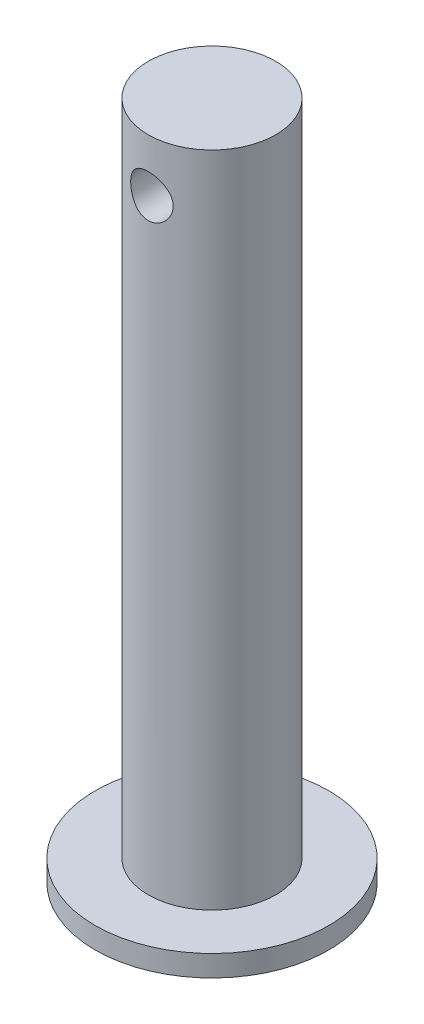
from build123d import *

# Parameters (mm, degrees)
SKETCH1_R           = 5.5
BOSS_EXTRUDE1_DEPTH = 1
SKETCH2_R           = 3
BOSS_EXTRUDE2_DEPTH = 31
SKETCH3_R           = 1
CUT_EXTRUDE1_DEPTH  = 15.5


with BuildPart() as part:
    # Sketch1 → Boss-Extrude1 (new body)
    with BuildSketch(Plane(origin=(0, 0, 0), x_dir=(1, 0, 0), z_dir=(0, 1, 0))):
        with Locations(Location((0, 0, 0), (0, 0, 270))):
            Circle(SKETCH1_R)
    extrude(amount=BOSS_EXTRUDE1_DEPTH)

    # Sketch2 → Boss-Extrude2 (add)
    with BuildSketch(Plane(origin=(0, 1, 0), x_dir=(1, 0, 0), z_dir=(0, 1, 0))):
        with Locations(Location((0, 0, 0), (0, 0, 270))):
            Circle(SKETCH2_R)
    extrude(amount=BOSS_EXTRUDE2_DEPTH)

    # Sketch3 → Cut-Extrude1 (cut, symmetric)
    with BuildSketch(Plane.XY):
        with Locations(Location((0, 29.5, 0), (0, 0, 89.999999987))):
            Circle(SKETCH3_R)
    extrude(amount=CUT_EXTRUDE1_DEPTH, both=True, mode=Mode.SUBTRACT)


solid = part.part
